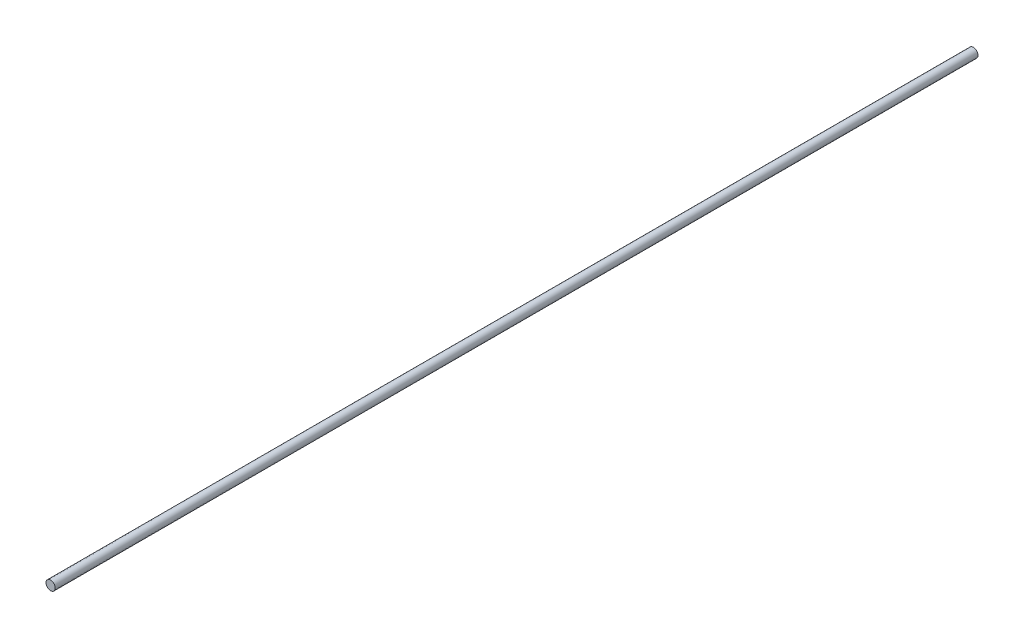
from build123d import *

# Parameters (mm, degrees)
SKETCH1_R           = 0.5
BOSS_EXTRUDE1_DEPTH = 100


with BuildPart() as part:
    # Sketch1 → Boss-Extrude1 (new body)
    with BuildSketch(Plane.XY):
        Circle(SKETCH1_R)
    extrude(amount=BOSS_EXTRUDE1_DEPTH)


solid = part.part
